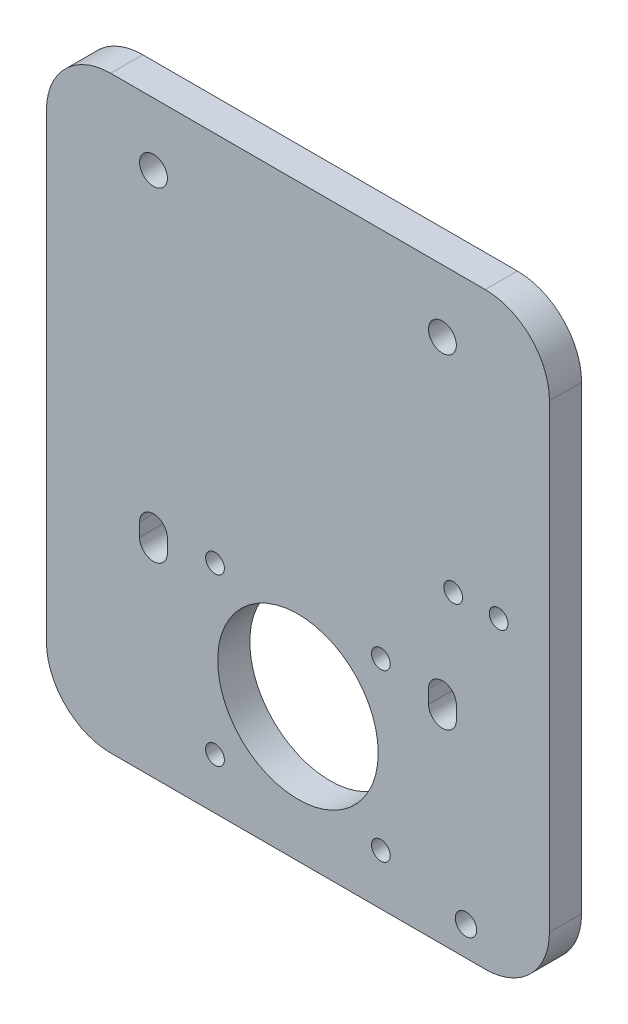
from build123d import *

# Parameters (mm, degrees)
MODEL_R               = 1.75
MODEL_R_2             = 15
MODEL_R_3             = 2.6
BASE_DEPTH            = 6
SKETCH1_R             = 1.75
CABLECHAINMOUNT_DEPTH = 10
SKETCH2_R             = 2
CABLETIEMOUNT_DEPTH   = 120.770614092


with BuildPart() as part:
    # Model → Base (new body)
    with BuildSketch(Plane.XY):
        with BuildLine():
            Line((47, 98), (47, 12))
            ThreePointArc((47, 12), (43.485281374, 3.514718626), (35, 0))
            Line((35, 0), (-35, 0))
            ThreePointArc((-35, 0), (-43.485281374, 3.514718626), (-47, 12))
            Line((-47, 12), (-47, 98))
            ThreePointArc((-47, 98), (-43.485281374, 106.485281374), (-35, 110))
            Line((-35, 110), (35, 110))
            ThreePointArc((35, 110), (43.485281374, 106.485281374), (47, 98))
        make_face()
        with Locations((15.5, 9.5)):
            Circle(MODEL_R, mode=Mode.SUBTRACT)
        with Locations((15.5, 40.5)):
            Circle(MODEL_R, mode=Mode.SUBTRACT)
        with Locations((-15.5, 40.5)):
            Circle(MODEL_R, mode=Mode.SUBTRACT)
        with Locations((-15.5, 9.5)):
            Circle(MODEL_R, mode=Mode.SUBTRACT)
        with Locations((0, 25)):
            Circle(MODEL_R_2, mode=Mode.SUBTRACT)
        with Locations((27, 98.3)):
            Circle(MODEL_R_3, mode=Mode.SUBTRACT)
        with Locations((-27, 98.3)):
            Circle(MODEL_R_3, mode=Mode.SUBTRACT)
        with BuildLine():
            Line((-24.4, 37.6), (-24.4, 40.1))
            ThreePointArc((-24.4, 40.1), (-27, 42.7), (-29.6, 40.1))
            Line((-29.6, 40.1), (-29.6, 37.6))
            ThreePointArc((-29.6, 37.6), (-27, 35), (-24.4, 37.6))
        make_face(mode=Mode.SUBTRACT)
        with BuildLine():
            Line((24.4, 40.1), (24.4, 37.6))
            ThreePointArc((24.4, 37.6), (27, 35), (29.6, 37.6))
            Line((29.6, 37.6), (29.6, 40.1))
            ThreePointArc((29.6, 40.1), (27, 42.7), (24.4, 40.1))
        make_face(mode=Mode.SUBTRACT)
    extrude(amount=BASE_DEPTH)

    # Sketch1 → CableChainMount (cut)
    with BuildSketch(Plane(origin=(0, 0, 0), x_dir=(-1, 0, 0), z_dir=(0, 0, -1))):
        with Locations((-29, 58)):
            Circle(SKETCH1_R)
        with Locations((-37.5, 58)):
            Circle(SKETCH1_R)
    extrude(amount=-CABLECHAINMOUNT_DEPTH, mode=Mode.SUBTRACT)

    # Sketch2 → CableTieMount (cut, through all)
    with BuildSketch(Plane.XY.offset(6)):
        with Locations((31.394827987, 5.505711601)):
            Circle(SKETCH2_R)
    extrude(amount=-CABLETIEMOUNT_DEPTH, mode=Mode.SUBTRACT)


solid = part.part
